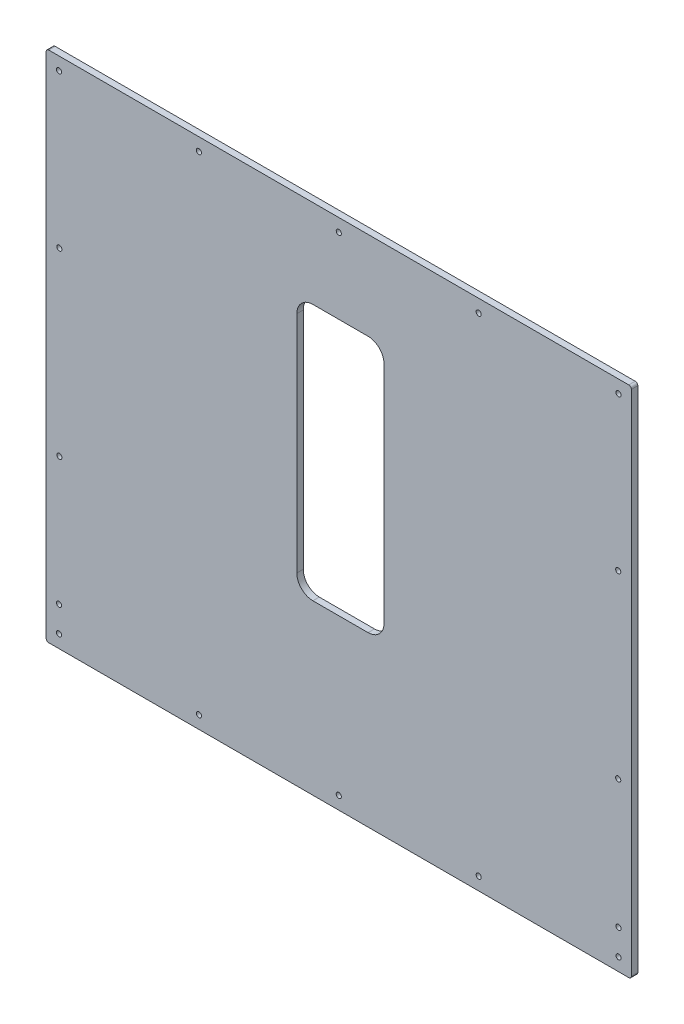
from build123d import *

# Parameters (mm, degrees)
ESQUISSE1_R             = 4
BOSS_EXTRU_1_DEPTH      = 10
ENL_V_MAT_EXTRU_1_DEPTH = 607.65970692


with BuildPart() as part:
    # Esquisse1 → Boss.-Extru.1 (new body)
    with BuildSketch(Plane.XY):
        with BuildLine():
            Line((-452, -400), (452, -400))
            ThreePointArc((452, -400), (454.828427125, -398.828427125), (456, -396))
            Line((456, -396), (456, 396))
            ThreePointArc((456, 396), (454.828427125, 398.828427125), (452, 400))
            Line((452, 400), (-452, 400))
            ThreePointArc((-452, 400), (-454.828427125, 398.828427125), (-456, 396))
            Line((-456, 396), (-456, -396))
            ThreePointArc((-456, -396), (-454.828427125, -398.828427125), (-452, -400))
        make_face()
        with Locations((436, 380)):
            Circle(ESQUISSE1_R, mode=Mode.SUBTRACT)
        with Locations((435.5, -140)):
            Circle(ESQUISSE1_R, mode=Mode.SUBTRACT)
        with Locations((435.5, 141)):
            Circle(ESQUISSE1_R, mode=Mode.SUBTRACT)
        with Locations(Location((-435.5, -140, 0), (0, 0, 180))):
            Circle(ESQUISSE1_R, mode=Mode.SUBTRACT)
        with Locations(Location((-436, 380, 0), (0, 0, 180))):
            Circle(ESQUISSE1_R, mode=Mode.SUBTRACT)
        with Locations(Location((-435.5, 141, 0), (0, 0, 180))):
            Circle(ESQUISSE1_R, mode=Mode.SUBTRACT)
        with Locations(Location((436, -380, 0), (0, 0, 180))):
            Circle(ESQUISSE1_R, mode=Mode.SUBTRACT)
        with Locations(Location((436, -340, 0), (0, 0, 180))):
            Circle(ESQUISSE1_R, mode=Mode.SUBTRACT)
        with Locations((-436, -340)):
            Circle(ESQUISSE1_R, mode=Mode.SUBTRACT)
        with Locations((-436, -380)):
            Circle(ESQUISSE1_R, mode=Mode.SUBTRACT)
        with Locations(Location((218, -380, 0), (0, 0, 180))):
            Circle(ESQUISSE1_R, mode=Mode.SUBTRACT)
        with Locations(Location((0, -380, 0), (0, 0, 180))):
            Circle(ESQUISSE1_R, mode=Mode.SUBTRACT)
        with Locations(Location((-218, -380, 0), (0, 0, 180))):
            Circle(ESQUISSE1_R, mode=Mode.SUBTRACT)
        with Locations((-218, 380)):
            Circle(ESQUISSE1_R, mode=Mode.SUBTRACT)
        with Locations((0, 380)):
            Circle(ESQUISSE1_R, mode=Mode.SUBTRACT)
        with Locations((218, 380)):
            Circle(ESQUISSE1_R, mode=Mode.SUBTRACT)
    extrude(amount=BOSS_EXTRU_1_DEPTH)

    # Esquisse2 → Enlèv. mat.-Extru.1 (cut, through all)
    with BuildSketch(Plane.XY.offset(10)):
        with BuildLine():
            Line((-40.379684406, -137.501440844), (45.577215583, -137.501440844))
            ThreePointArc((45.577215583, -137.501440844), (63.254885113, -130.179110374), (70.577215583, -112.501440844))
            Line((70.577215583, -112.501440844), (70.577215583, 237.498559156))
            ThreePointArc((70.577215583, 237.498559156), (63.254885113, 255.176228686), (45.577215583, 262.498559156))
            Line((45.577215583, 262.498559156), (-40.379684406, 262.498559156))
            ThreePointArc((-40.379684406, 262.498559156), (-58.057353936, 255.176228686), (-65.379684406, 237.498559156))
            Line((-65.379684406, 237.498559156), (-65.379684406, -112.501440844))
            ThreePointArc((-65.379684406, -112.501440844), (-58.057353936, -130.179110374), (-40.379684406, -137.501440844))
        make_face()
    extrude(amount=-ENL_V_MAT_EXTRU_1_DEPTH, mode=Mode.SUBTRACT)


solid = part.part
